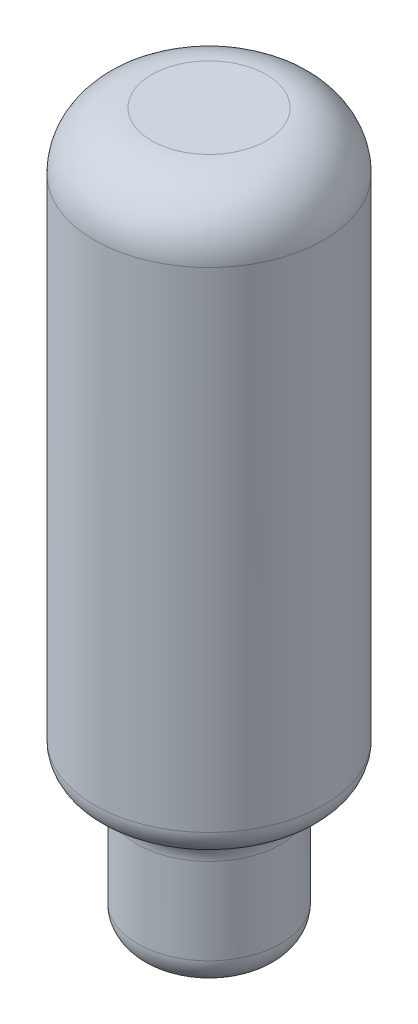
from build123d import *

# Parameters (mm, degrees)
SKETCH1_R           = 4
BOSS_EXTRUDE1_DEPTH = 20
SKETCH2_R           = 2.5
BOSS_EXTRUDE2_DEPTH = 5
FILLET1_R           = 1
FILLET2_R           = 2
FILLET3_R           = 1
FILLET4_R           = 1


with BuildPart() as part:
    # Sketch1 → Boss-Extrude1 (new body)
    with BuildSketch(Plane(origin=(0, 0, 0), x_dir=(1, 0, 0), z_dir=(0, 1, 0))):
        with Locations(Location((0, 0, 0), (0, 0, 270))):
            Circle(SKETCH1_R)
    extrude(amount=BOSS_EXTRUDE1_DEPTH)

    # Sketch2 → Boss-Extrude2 (add)
    with BuildSketch(Plane.XZ):
        with Locations(Location((0, 0, 0), (0, 0, 270))):
            Circle(SKETCH2_R)
    extrude(amount=BOSS_EXTRUDE2_DEPTH)

    # Fillet1
    fillet1_edges = [part.edges().sort_by_distance(p)[0] for p in [
        (0, 0, 2.5),
    ]]
    fillet(fillet1_edges, radius=FILLET1_R)

    # Fillet2
    fillet2_edges = [part.edges().sort_by_distance(p)[0] for p in [
        (0, 20, -4),
    ]]
    fillet(fillet2_edges, radius=FILLET2_R)

    # Fillet3
    fillet3_edges = [part.edges().sort_by_distance(p)[0] for p in [
        (0, 0, -4),
    ]]
    fillet(fillet3_edges, radius=FILLET3_R)

    # Fillet4
    fillet4_edges = [part.edges().sort_by_distance(p)[0] for p in [
        (0, -5, 2.5),
    ]]
    fillet(fillet4_edges, radius=FILLET4_R)


solid = part.part
